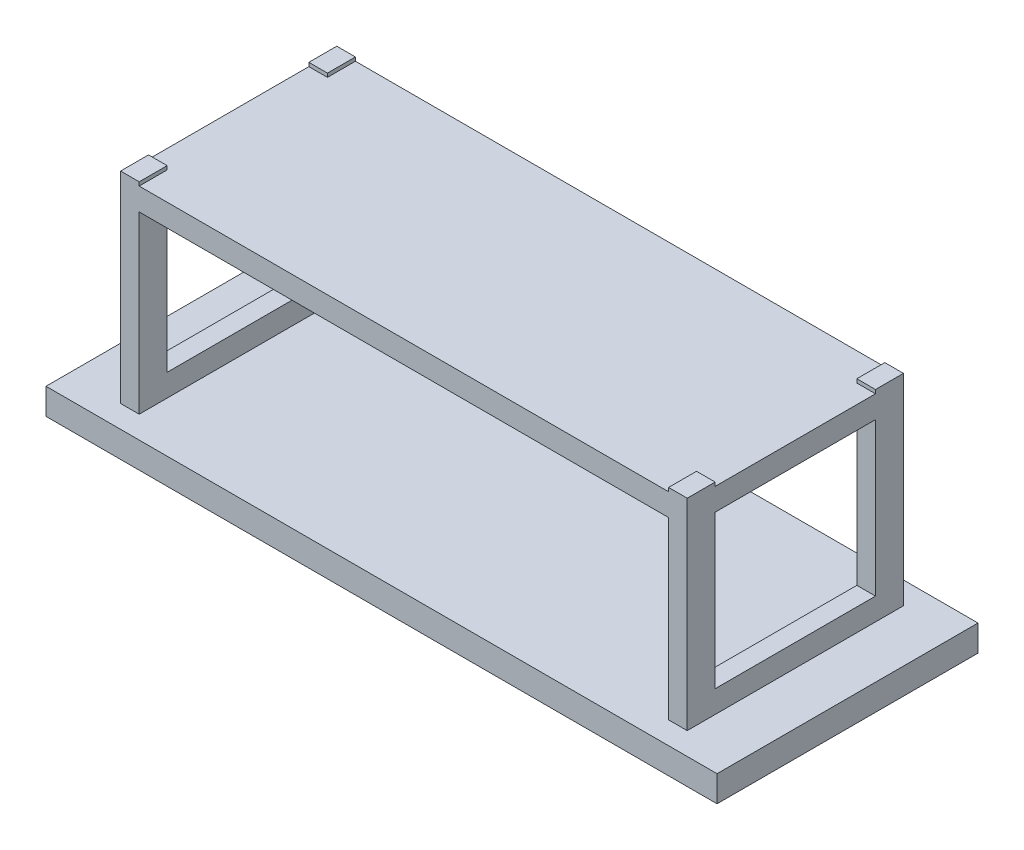
from build123d import *

# Parameters (mm, degrees)
SKETCH_1_W      = 1800
SKETCH_1_H      = 700
EXTRUDE_1_DEPTH = 70
SKETCH_2_W      = 50
SKETCH_2_H      = 580
EXTRUDE_2_DEPTH = 60
SKETCH_3_W      = 50
SKETCH_3_H      = 75
EXTRUDE_3_DEPTH = 480
EXTRUDE_4_REACH = 1984.757
SKETCH_4_W      = 50
SKETCH_4_H      = 60
EXTRUDE_5_REACH = 1860.548
SKETCH_5_W      = 580
SKETCH_5_H      = 60


with BuildPart() as part:
    # ｽｹｯﾁ1 → ﾎﾞｽ - 押し出し1 (new body)
    with BuildSketch(Plane(origin=(0, 0, 0), x_dir=(1, 0, 0), z_dir=(0, 1, 0))):
        with Locations((900, 350)):
            Rectangle(SKETCH_1_W, SKETCH_1_H)
    extrude(amount=EXTRUDE_1_DEPTH)

    # ｽｹｯﾁ2 → ﾎﾞｽ - 押し出し2 (add)
    with BuildSketch(Plane(origin=(0, 70, 0), x_dir=(1, 0, 0), z_dir=(0, 1, 0))):
        with Locations((165, 350)):
            Rectangle(SKETCH_2_W, SKETCH_2_H)
        with Locations((1635, 350)):
            Rectangle(SKETCH_2_W, SKETCH_2_H)
    extrude(amount=EXTRUDE_2_DEPTH)

    # ｽｹｯﾁ3 → ﾎﾞｽ - 押し出し3 (add)
    with BuildSketch(Plane(origin=(0, 130, 0), x_dir=(1, 0, 0), z_dir=(0, 1, 0))):
        with Locations((165, 602.5)):
            Rectangle(SKETCH_3_W, SKETCH_3_H)
        with Locations((165, 97.5)):
            Rectangle(SKETCH_3_W, SKETCH_3_H)
        with Locations((1635, 602.5)):
            Rectangle(SKETCH_3_W, SKETCH_3_H)
        with Locations((1635, 97.5)):
            Rectangle(SKETCH_3_W, SKETCH_3_H)
    extrude(amount=EXTRUDE_3_DEPTH)

    # ｽｹｯﾁ4 → ﾎﾞｽ - 押し出し4 (add, up to next)
    with BuildSketch(Plane.XY.offset(-565), mode=Mode.PRIVATE) as extrude_4_sk1:
        with Locations((1635, 570)):
            Rectangle(SKETCH_4_W, SKETCH_4_H)
    extrude_4_tool1 = extrude(extrude_4_sk1.sketch, amount=EXTRUDE_4_REACH, mode=Mode.PRIVATE) - part.part
    # ｽｹｯﾁ4 → ﾎﾞｽ - 押し出し4 (add, up to next)
    with BuildSketch(Plane.XY.offset(-565), mode=Mode.PRIVATE) as extrude_4_sk2:
        with Locations((165, 570)):
            Rectangle(SKETCH_4_W, SKETCH_4_H)
    extrude_4_tool2 = extrude(extrude_4_sk2.sketch, amount=EXTRUDE_4_REACH, mode=Mode.PRIVATE) - part.part
    add(extrude_4_tool1.solids().sort_by_distance((1635, 570, -565))[0])
    add(extrude_4_tool2.solids().sort_by_distance((165, 570, -565))[0])

    # ｽｹｯﾁ5 → ﾎﾞｽ - 押し出し5 (add, up to next)
    with BuildSketch(Plane.ZY.offset(-1610), mode=Mode.PRIVATE) as extrude_5_sk1:
        with Locations((-350, 570)):
            Rectangle(SKETCH_5_W, SKETCH_5_H)
    extrude_5_tool1 = extrude(extrude_5_sk1.sketch, amount=EXTRUDE_5_REACH, mode=Mode.PRIVATE) - part.part
    add(extrude_5_tool1.solids().sort_by_distance((1610, 570, -350))[0])


solid = part.part
